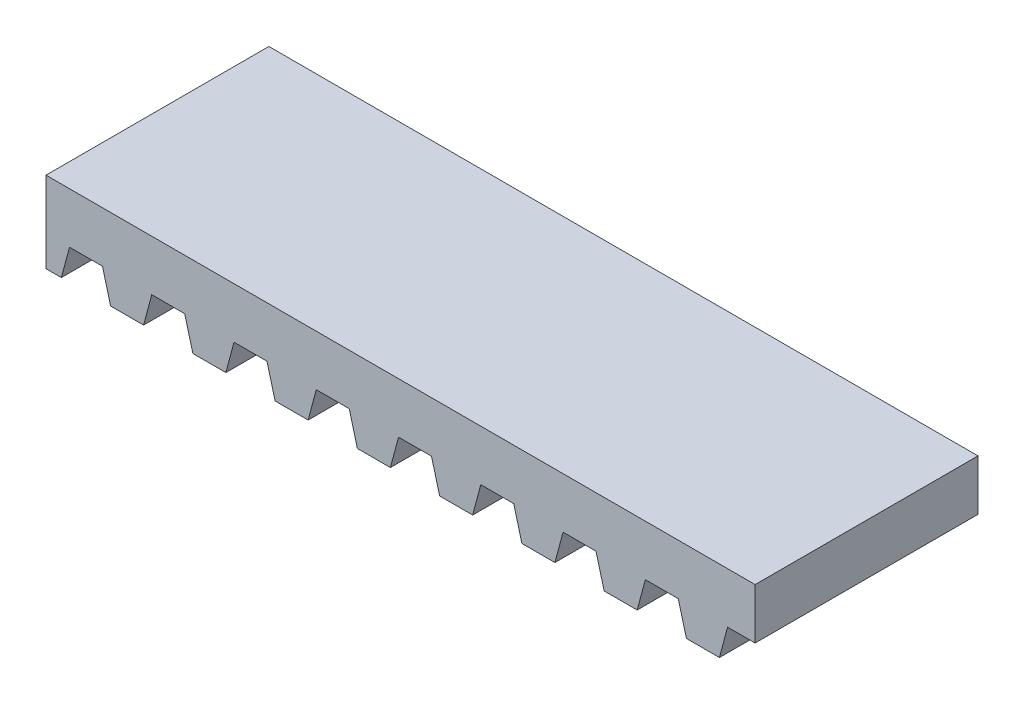
from build123d import *

# Parameters (mm, degrees)
SKETCH_1_W          = 70
SKETCH_1_H          = 5
EXTRUDE_1_DEPTH     = 22
EXTRUDE_2_DEPTH     = 10
SKETCH_3_R          = 1.7
CUT_EXTRUDE_1_DEPTH = 8
SKETCH_5_R          = 1.7
CUT_EXTRUDE_2_DEPTH = 8


with BuildPart() as part:
    # 草圖1 → 填料-伸長1 (new body)
    with BuildSketch(Plane.XY):
        with Locations((2.778517987, 7.348484848)):
            Rectangle(SKETCH_1_W, SKETCH_1_H)
    extrude(amount=EXTRUDE_1_DEPTH)

    # 草圖2 → 填料-伸長2 (add)
    with BuildSketch(Plane.XY.offset(22)):
        Polygon((-32.221482013, 1.848484848), (-30.705054647, 1.848484848), (-29.90120707, 4.848484848), (-32.221482013, 4.848484848), align=None)
        Polygon((-25.84420707, 1.848484848), (-22.585054647, 1.848484848), (-21.78120707, 4.848484848), (-26.648054647, 4.848484848), align=None)
        Polygon((-18.528054647, 4.848484848), (-17.72420707, 1.848484848), (-14.465054647, 1.848484848), (-13.66120707, 4.848484848), align=None)
        Polygon((-10.408054647, 4.848484848), (-9.60420707, 1.848484848), (-6.345054647, 1.848484848), (-5.54120707, 4.848484848), align=None)
        Polygon((-2.288054647, 4.848484848), (-1.48420707, 1.848484848), (1.774945353, 1.848484848), (2.57879293, 4.848484848), align=None)
        Polygon((5.831945353, 4.848484848), (6.63579293, 1.848484848), (9.894945353, 1.848484848), (10.69879293, 4.848484848), align=None)
        Polygon((13.951945353, 4.848484848), (14.75579293, 1.848484848), (18.014945353, 1.848484848), (18.81879293, 4.848484848), align=None)
        Polygon((22.071945353, 4.848484848), (22.87579293, 1.848484848), (26.134945353, 1.848484848), (26.93879293, 4.848484848), align=None)
        Polygon((30.191945353, 4.848484848), (30.99579293, 1.848484848), (34.254945353, 1.848484848), (35.05879293, 4.848484848), align=None)
    extrude(amount=-EXTRUDE_2_DEPTH)

    # 草圖3 → 除料-伸長1 (cut)
    with BuildSketch(Plane(origin=(0, 0, 0), x_dir=(-1, 0, 0), z_dir=(0, 0, -1))):
        with Locations((-32.778517987, 7.348484848)):
            Circle(SKETCH_3_R)
        with Locations((-2.778517987, 7.348484848)):
            Circle(SKETCH_3_R)
        with Locations((27.221482013, 7.348484848)):
            Circle(SKETCH_3_R)
    extrude(amount=-CUT_EXTRUDE_1_DEPTH, mode=Mode.SUBTRACT)

    # 草圖5 → 除料-伸長2 (cut)
    with BuildSketch(Plane.ZY.offset(32.221482013)):
        with Locations((10, 7.348484848)):
            Circle(SKETCH_5_R)
        with Locations((18, 7.348484848)):
            Circle(SKETCH_5_R)
    extrude(amount=-CUT_EXTRUDE_2_DEPTH, mode=Mode.SUBTRACT)


solid = part.part
